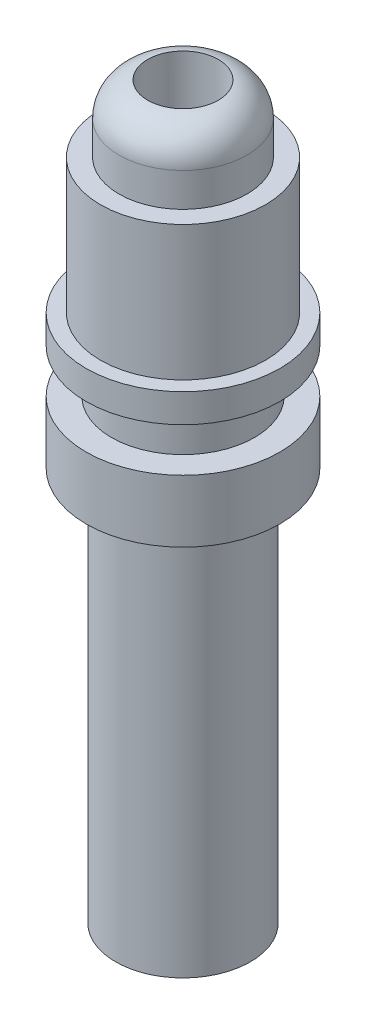
from build123d import *

# Parameters (mm, degrees)
SKETCH1_R           = 5.75
BOSS_EXTRUDE1_DEPTH = 16
SKETCH2_OUTSIDE_W   = 18.062
SKETCH2_OUTSIDE_H   = 18.062
SKETCH2_OUTSIDE_R   = 4.9
CUT_EXTRUDE1_DEPTH  = 8
SKETCH3_R           = 3.8
BOSS_EXTRUDE2_DEPTH = 4
FILLET2_R           = 2
SKETCH4_R           = 4
BOSS_EXTRUDE3_DEPTH = 23.4
SKETCH12_W          = 1.5
SKETCH12_H          = 2.6
CUT_EXTRUDE2_REACH  = 46.155
SKETCH5_R           = 1.25
SKETCH13_R          = 2.1
CUT_EXTRUDE3_DEPTH  = 12


with BuildPart() as part:
    # Sketch1 → Boss-Extrude1 (new body)
    with BuildSketch(Plane(origin=(0, 0, 0), x_dir=(1, 0, 0), z_dir=(0, 1, 0))):
        with Locations(Location((0, 0, 0), (0, 0, 270))):
            Circle(SKETCH1_R)
    extrude(amount=BOSS_EXTRUDE1_DEPTH)

    # Sketch2 outside → Cut-Extrude1 (cut)
    with BuildSketch(Plane(origin=(0, 16, 0), x_dir=(1, 0, 0), z_dir=(0, 1, 0))):
        Rectangle(SKETCH2_OUTSIDE_W, SKETCH2_OUTSIDE_H)
        with Locations(Location((0, 0, 0), (0, 0, 270))):
            Circle(SKETCH2_OUTSIDE_R, mode=Mode.SUBTRACT)
    extrude(amount=-CUT_EXTRUDE1_DEPTH, mode=Mode.SUBTRACT)

    # Sketch3 → Boss-Extrude2 (add)
    with BuildSketch(Plane(origin=(0, 16, 0), x_dir=(1, 0, 0), z_dir=(0, 1, 0))):
        with Locations(Location((0, 0, 0), (0, 0, 270))):
            Circle(SKETCH3_R)
    extrude(amount=BOSS_EXTRUDE2_DEPTH)

    # Fillet2
    fillet2_edges = [part.edges().sort_by_distance(p)[0] for p in [
        (0, 20, -3.8),
    ]]
    fillet(fillet2_edges, radius=FILLET2_R)

    # Sketch4 → Boss-Extrude3 (add)
    with BuildSketch(Plane.XZ):
        with Locations(Location((0, 0, 0), (0, 0, 270))):
            Circle(SKETCH4_R)
    extrude(amount=BOSS_EXTRUDE3_DEPTH)

    # Sketch12 → Cut-Revolve2 (revolve, cut)
    with BuildSketch(Plane(origin=(0, 0, 0), x_dir=(0, 0, -1), z_dir=(1, 0, 0))):
        with Locations((-5, 5)):
            Rectangle(SKETCH12_W, SKETCH12_H)
    revolve(axis=Axis((0, 8, 0), (0, -1, 0)), mode=Mode.SUBTRACT)

    # Sketch5 → Cut-Extrude2 (cut, up to next)
    with BuildSketch(Plane.XZ.offset(23.4), mode=Mode.PRIVATE) as cut_extrude2_sk1:
        with Locations(Location((0, 0, 0), (0, 0, 270))):
            Circle(SKETCH5_R)
    cut_extrude2_tool1 = extrude(cut_extrude2_sk1.sketch, amount=-CUT_EXTRUDE2_REACH, mode=Mode.PRIVATE) & part.part
    add(cut_extrude2_tool1.solids().sort_by_distance((0, -23.4, 0))[0], mode=Mode.SUBTRACT)

    # Sketch13 → Cut-Extrude3 (cut)
    with BuildSketch(Plane(origin=(0, 20, 0), x_dir=(1, 0, 0), z_dir=(0, 1, 0))):
        with Locations(Location((0, 0, 0), (0, 0, 270))):
            Circle(SKETCH13_R)
    extrude(amount=-CUT_EXTRUDE3_DEPTH, mode=Mode.SUBTRACT)


solid = part.part
